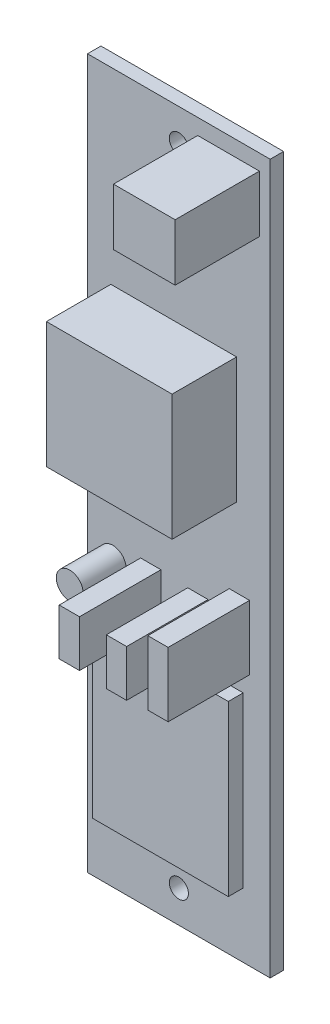
from build123d import *

# Parameters (mm, degrees)
SKETCH1_W                = 21.59
SKETCH1_H                = 83.82
BOSS_EXTRUDE1_DEPTH      = 1.5875
SKETCH2_W                = 7.2898
SKETCH2_H                = 6.7056
BOSS_EXTRUDE2_DEPTH      = 9.9568
SKETCH3_W                = 14.859
SKETCH3_H                = 14.859
BOSS_EXTRUDE3_DEPTH      = 7.62
SKETCH4_W                = 16.0528
SKETCH4_H                = 19.9771
BOSS_EXTRUDE4_DEPTH      = 1.7653
SKETCH5_W                = 2.4003
SKETCH5_H                = 7.62
BOSS_EXTRUDE5_DEPTH      = 9.6266
SKETCH6_W                = 2.4003
SKETCH6_H                = 5.5118
BOSS_EXTRUDE6_DEPTH      = 9.6266
SKETCH7_W                = 2.4003
SKETCH7_H                = 5.5118
BOSS_EXTRUDE7_DEPTH      = 9.6266
SKETCH8_W                = 1.5875
SKETCH8_H                = 5.08
M2_CLEARANCE_HOLE1_D     = 2.2606
M2_CLEARANCE_HOLE1_DEPTH = 11.5443


with BuildPart() as part:
    # Sketch1 → Boss-Extrude1 (new body)
    with BuildSketch(Plane.XY.offset(1.5875)):
        Rectangle(SKETCH1_W, SKETCH1_H)
    extrude(amount=-BOSS_EXTRUDE1_DEPTH)

    # Sketch2 → Boss-Extrude2 (add)
    with BuildSketch(Plane.XY.offset(1.5875)):
        with Locations((5.875618033, 36.702635151)):
            Rectangle(SKETCH2_W, SKETCH2_H)
    extrude(amount=BOSS_EXTRUDE2_DEPTH)

    # Sketch3 → Boss-Extrude3 (add)
    with BuildSketch(Plane.XY.offset(1.5875)):
        with Locations((-0.605361647, 12.25549996)):
            Rectangle(SKETCH3_W, SKETCH3_H)
    extrude(amount=BOSS_EXTRUDE3_DEPTH)

    # Sketch4 → Boss-Extrude4 (add)
    with BuildSketch(Plane.XY.offset(1.5875)):
        with Locations((-0.417085014, -24.301450796)):
            Rectangle(SKETCH4_W, SKETCH4_H)
    extrude(amount=BOSS_EXTRUDE4_DEPTH)

    # Sketch5 → Boss-Extrude5 (add)
    with BuildSketch(Plane.XY.offset(1.5875)):
        with Locations((7.159963177, -8.2804)):
            Rectangle(SKETCH5_W, SKETCH5_H)
    extrude(amount=BOSS_EXTRUDE5_DEPTH)

    # Sketch6 → Boss-Extrude6 (add)
    with BuildSketch(Plane.XY.offset(1.5875)):
        with Locations((2.253736662, -9.58954063)):
            Rectangle(SKETCH6_W, SKETCH6_H)
    extrude(amount=BOSS_EXTRUDE6_DEPTH)

    # Sketch7 → Boss-Extrude7 (add)
    with BuildSketch(Plane.XY.offset(1.5875)):
        with Locations((-3.316385546, -9.326175129)):
            Rectangle(SKETCH7_W, SKETCH7_H)
    extrude(amount=BOSS_EXTRUDE7_DEPTH)

    # Sketch8 → Revolve1 (revolve)
    with BuildSketch(Plane.XZ.offset(8.500092663), mode=Mode.PRIVATE) as revolve1_sk:
        with Locations((-7.022506024, 4.1275)):
            Rectangle(SKETCH8_W, SKETCH8_H)
    revolve(revolve1_sk.sketch.rotate(Axis((-7.816256024, -8.500092663, 6.6675), (0, 0, -1)), 180), axis=Axis((-7.816256024, -8.500092663, 6.6675), (0, 0, -1)))

    # M2 Clearance Hole1
    with Locations(Plane(origin=(0, 0, 0), x_dir=(-1, 0, 0), z_dir=(0, 0, -1))):
        with Locations((0, -38.1), (0, 38.1)):
            Hole(M2_CLEARANCE_HOLE1_D / 2, depth=M2_CLEARANCE_HOLE1_DEPTH)


solid = part.part
